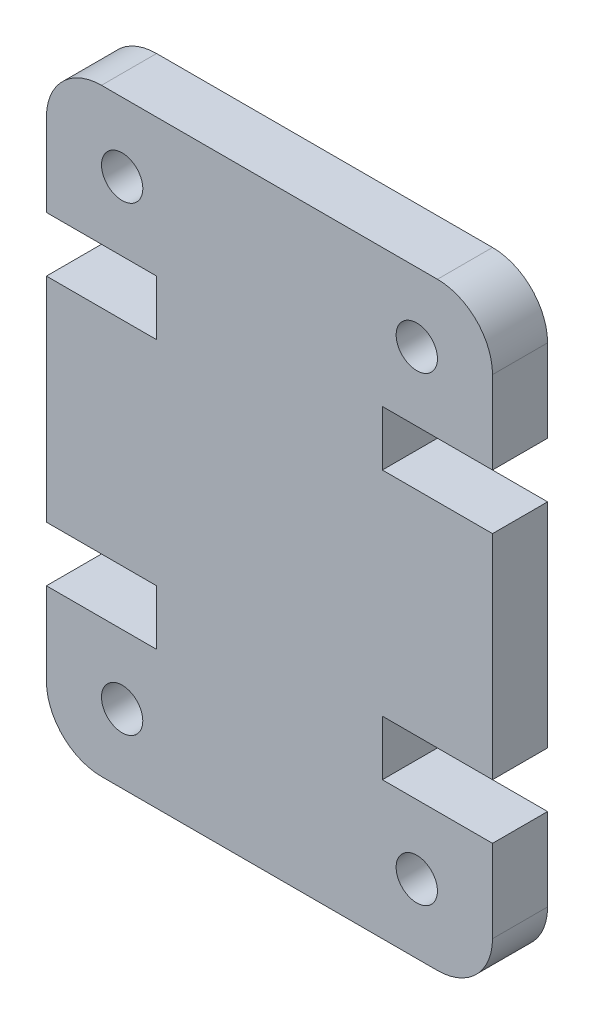
from build123d import *

# Parameters (mm, degrees)
SKETCH1_R           = 0.75
BOSS_EXTRUDE1_DEPTH = 4
SKETCH2_W           = 16.2
SKETCH2_H           = 21.74
CUT_EXTRUDE1_DEPTH  = 2


with BuildPart() as part:
    # Sketch1 → Boss-Extrude1 (new body)
    with BuildSketch(Plane.XY):
        with BuildLine():
            Line((0, 14.74), (0, 7))
            Line((0, 7), (4, 7))
            Line((4, 7), (4, 5))
            Line((4, 5), (0, 5))
            Line((0, 5), (0, 2))
            ThreePointArc((0, 2), (0.585786438, 0.585786438), (2, 0))
            Line((2, 0), (14.2, 0))
            ThreePointArc((14.2, 0), (15.614213562, 0.585786438), (16.2, 2))
            Line((16.2, 2), (16.2, 5))
            Line((16.2, 5), (12.2, 5))
            Line((12.2, 5), (12.2, 7))
            Line((12.2, 7), (16.2, 7))
            Line((16.2, 7), (16.2, 14.74))
            Line((16.2, 14.74), (12.2, 14.74))
            Line((12.2, 14.74), (12.2, 16.74))
            Line((12.2, 16.74), (16.2, 16.74))
            Line((16.2, 16.74), (16.2, 19.74))
            ThreePointArc((16.2, 19.74), (15.614213562, 21.154213562), (14.2, 21.74))
            Line((14.2, 21.74), (2, 21.74))
            ThreePointArc((2, 21.74), (0.585786438, 21.154213562), (0, 19.74))
            Line((0, 19.74), (0, 16.74))
            Line((0, 16.74), (4, 16.74))
            Line((4, 16.74), (4, 14.74))
            Line((4, 14.74), (0, 14.74))
        make_face()
        with Locations((13.45, 2.5)):
            Circle(SKETCH1_R, mode=Mode.SUBTRACT)
        with Locations((2.75, 19.24)):
            Circle(SKETCH1_R, mode=Mode.SUBTRACT)
        with Locations((2.75, 2.5)):
            Circle(SKETCH1_R, mode=Mode.SUBTRACT)
        with Locations((13.45, 19.24)):
            Circle(SKETCH1_R, mode=Mode.SUBTRACT)
    extrude(amount=BOSS_EXTRUDE1_DEPTH)

    # Sketch2 → Cut-Extrude1 (cut)
    with BuildSketch(Plane(origin=(0, 0, 0), x_dir=(-1, 0, 0), z_dir=(0, 0, -1))):
        with Locations((-8.1, 10.87)):
            Rectangle(SKETCH2_W, SKETCH2_H)
    extrude(amount=-CUT_EXTRUDE1_DEPTH, mode=Mode.SUBTRACT)


solid = part.part
